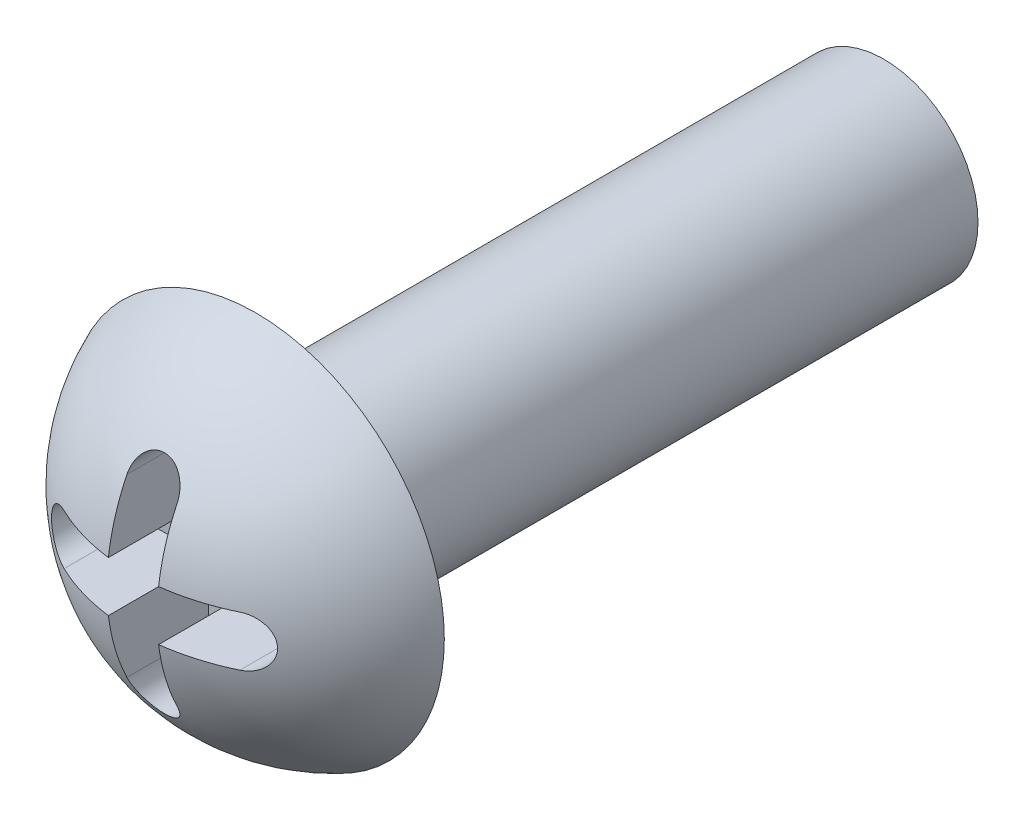
from build123d import *

# Parameters (mm, degrees)
ENL_V_MAT_EXTRU_1_REACH      = 31.166
ENL_V_MAT_EXTRU_1_END_RADIUS = 1.625
ESQUISSE3_W                  = 0.75
ESQUISSE3_H                  = 5


with BuildPart() as part:
    # Esquisse1 → Révolution1 (revolve)
    with BuildSketch(Plane(origin=(0, 0, 0), x_dir=(1, 0, 0), z_dir=(0, 1, 0)), mode=Mode.PRIVATE) as r_volution1_sk:
        with BuildLine():
            Line((-26.1153768, -30.3208848), (-27.6153768, -30.3208848))
            Line((-27.6153768, -30.3208848), (-27.6153768, -31.3208848))
            ThreePointArc((-27.6153768, -31.3208848), (-26.713988981, -31.047966528), (-26.1153768, -30.3208848))
        make_face()
    revolve(r_volution1_sk.sketch.rotate(Axis((-27.6153768, 0, 30.3208848), (0, 0, 1)), 180), axis=Axis((-27.6153768, 0, 30.3208848), (0, 0, 1)))

    # Enlèv. mat.-Extru.1: up to this sphere (the profile starts inside it)
    enl_v_mat_extru_1_end = Location((-27.6153768, 0, 29.6958848)) * Sphere(ENL_V_MAT_EXTRU_1_END_RADIUS, mode=Mode.PRIVATE)
    # Esquisse2 → Enlèv. mat.-Extru.1 (cut, up to the surface)
    with BuildSketch(Plane(origin=(0, 0, 30.5), x_dir=(-1, 0, 0), z_dir=(0, 0, -1)), mode=Mode.PRIVATE) as enl_v_mat_extru_1_sk1:
        with BuildLine():
            Line((27.8153768, 0.2), (27.8153768, 0.7))
            ThreePointArc((27.8153768, 0.7), (27.6153768, 0.9), (27.4153768, 0.7))
            Line((27.4153768, 0.7), (27.4153768, 0.2))
            Line((27.4153768, 0.2), (26.9153768, 0.2))
            ThreePointArc((26.9153768, 0.2), (26.7153768, 0), (26.9153768, -0.2))
            Line((26.9153768, -0.2), (27.4153768, -0.2))
            Line((27.4153768, -0.2), (27.4153768, -0.7))
            ThreePointArc((27.4153768, -0.7), (27.6153768, -0.9), (27.8153768, -0.7))
            Line((27.8153768, -0.7), (27.8153768, -0.2))
            Line((27.8153768, -0.2), (28.3153768, -0.2))
            ThreePointArc((28.3153768, -0.2), (28.5153768, 0), (28.3153768, 0.2))
            Line((28.3153768, 0.2), (27.8153768, 0.2))
        make_face()
    enl_v_mat_extru_1_tool1 = extrude(enl_v_mat_extru_1_sk1.sketch, amount=-ENL_V_MAT_EXTRU_1_REACH, mode=Mode.PRIVATE) & enl_v_mat_extru_1_end
    add(enl_v_mat_extru_1_tool1.solids().sort_by_distance((-27.615377, 0, 30.5))[0], mode=Mode.SUBTRACT)

    # Esquisse3 → Révolution2 (revolve)
    with BuildSketch(Plane(origin=(0, 0, 0), x_dir=(1, 0, 0), z_dir=(0, 1, 0)), mode=Mode.PRIVATE) as r_volution2_sk:
        with Locations((-27.2403768, -27.8208848)):
            Rectangle(ESQUISSE3_W, ESQUISSE3_H)
    revolve(r_volution2_sk.sketch.rotate(Axis((-27.6153768, 0, 25.3208848), (0, 0, 1)), 195.945395901), axis=Axis((-27.6153768, 0, 25.3208848), (0, 0, 1)))


solid = part.part
